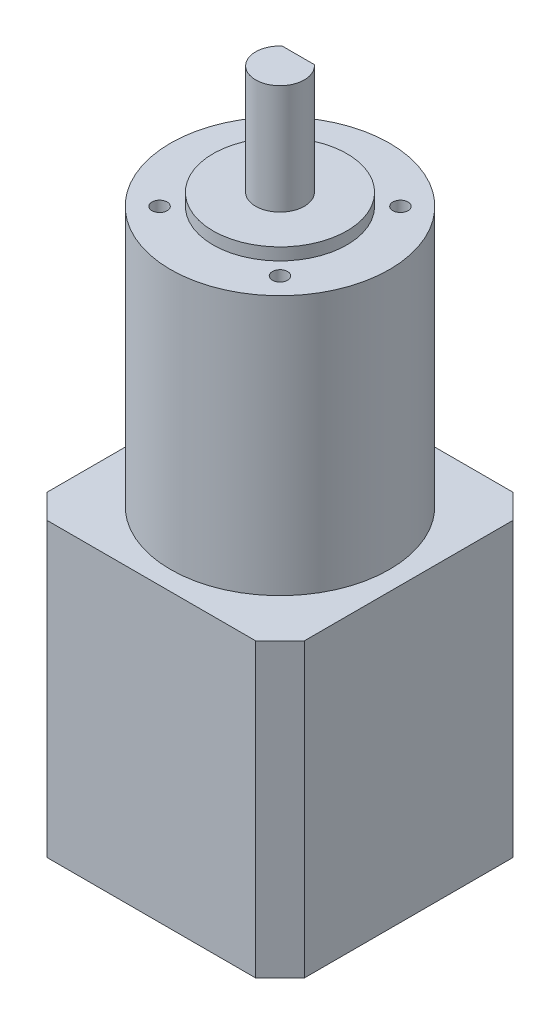
from build123d import *

# Parameters (mm, degrees)
ESQUISSE1_W                  = 42.3
ESQUISSE1_H                  = 42.3
MOTEUR_DEPTH                 = 48
CHANFREIN1_SIZE              = 4
ESQUISSE2_R                  = 18
BOSS_EXTRU_2_DEPTH           = 42.7
ESQUISSE3_R                  = 11
BOSS_EXTRU_3_DEPTH           = 2
ESQUISSE4_R                  = 4
BOSS_EXTRU_4_DEPTH           = 18
ESQUISSE5_W                  = 5.291502622
ESQUISSE5_H                  = 1
ENL_V_MAT_EXTRU_1_DEPTH      = 15
R_P_TITION_CIRCULAIRE1_COUNT = 4


with BuildPart() as part:
    # Esquisse1 → Moteur (new body)
    with BuildSketch(Plane(origin=(0, 0, 0), x_dir=(1, 0, 0), z_dir=(0, 1, 0))):
        Rectangle(ESQUISSE1_W, ESQUISSE1_H)
    extrude(amount=-MOTEUR_DEPTH)

    # Chanfrein1
    chanfrein1_edges = [part.edges().sort_by_distance(p)[0] for p in [
        (21.15, -24, -21.15),
        (-21.15, -24, -21.15),
        (-21.15, -24, 21.15),
        (21.15, -24, 21.15),
    ]]
    chamfer(chanfrein1_edges, length=CHANFREIN1_SIZE)

    # Esquisse2 → Boss.-Extru.2 (add)
    with BuildSketch(Plane(origin=(0, 0, 0), x_dir=(1, 0, 0), z_dir=(0, 1, 0))):
        Circle(ESQUISSE2_R)
    extrude(amount=BOSS_EXTRU_2_DEPTH)

    # Esquisse3 → Boss.-Extru.3 (add)
    with BuildSketch(Plane(origin=(0, 42.7, 0), x_dir=(1, 0, 0), z_dir=(0, 1, 0))):
        Circle(ESQUISSE3_R)
    extrude(amount=BOSS_EXTRU_3_DEPTH)

    # Esquisse4 → Boss.-Extru.4 (add)
    with BuildSketch(Plane(origin=(0, 44.7, 0), x_dir=(1, 0, 0), z_dir=(0, 1, 0))):
        Circle(ESQUISSE4_R)
    extrude(amount=BOSS_EXTRU_4_DEPTH)

    # Esquisse5 → Enlèv. mat.-Extru.1 (cut)
    with BuildSketch(Plane(origin=(0, 62.7, 0), x_dir=(1, 0, 0), z_dir=(0, 1, 0))):
        with Locations((0, 3.5)):
            Rectangle(ESQUISSE5_W, ESQUISSE5_H)
    extrude(amount=-ENL_V_MAT_EXTRU_1_DEPTH, mode=Mode.SUBTRACT)

    # Esquisse7 → Trou pour taraudage pour trou taraudé M3x0.51 (revolve, cut)
    with BuildSketch(Plane(origin=(-9.899494937, 42.7, -9.899494937), x_dir=(0, 0, 1), z_dir=(1, 0, 0))):
        Polygon((0, 0), (0, 5.751075774), (1.25, 5), (1.25, 0), align=None)
    trou_pour_taraudage_pour_trou_taraud_m3 = revolve(axis=Axis((-9.899494937, 49.05, -9.899494937), (0, -1, 0)), mode=Mode.SUBTRACT)

    # Répétition circulaire1: Trou pour taraudage pour trou taraudé M3x0.51 ×4 about axis
    r_p_tition_circulaire1_axis = Axis((0, 69.927993494, 0), (0, -1, 0))
    for i in range(1, R_P_TITION_CIRCULAIRE1_COUNT):
        add(trou_pour_taraudage_pour_trou_taraud_m3.rotate(r_p_tition_circulaire1_axis, i * 360 / R_P_TITION_CIRCULAIRE1_COUNT), mode=Mode.SUBTRACT)


solid = part.part
